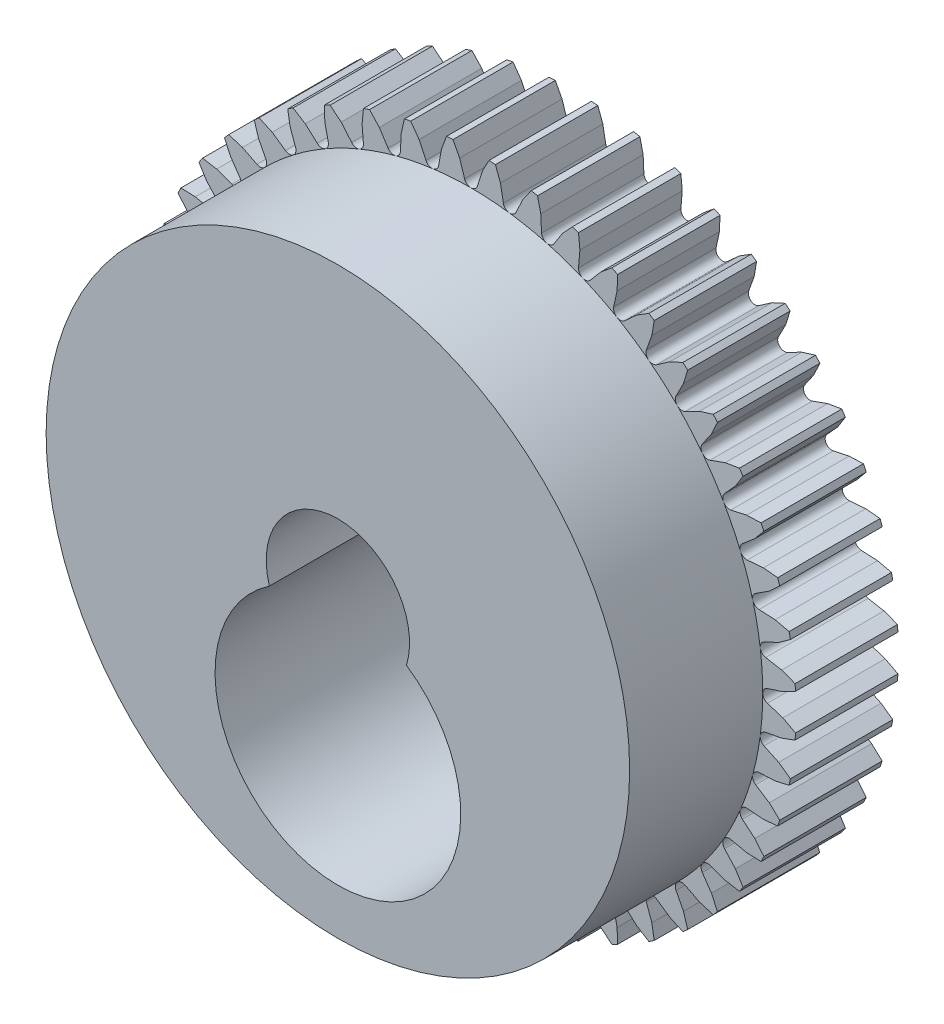
from build123d import *

# Parameters (mm, degrees)
BOSS_EXTRUDE1_DEPTH = 5
BOSS_EXTRUDE2_START = -5
SKETCH3_R           = 14.25
BOSS_EXTRUDE2_DEPTH = 11.5
CUT_EXTRUDE1_DEPTH  = 26.193798375


with BuildPart() as part:
    # Sketch2 → Boss-Extrude1 (new body)
    with BuildSketch(Plane.XY):
        with BuildLine():
            Line((-0.552366914, 15.229986566), (-0.881411777, 15.85051224))
            ThreePointArc((-0.881411777, 15.85051224), (-1.038274677, 15.841010406), (-1.19503583, 15.829956234))
            Line((-1.19503583, 15.829956234), (-1.440270816, 15.171790269))
            Line((-1.440270816, 15.171790269), (-1.581199665, 14.393740022))
            ThreePointArc((-1.581199665, 14.393740022), (-1.859998239, 14.128089275), (-2.198052455, 14.312529812))
            Line((-2.198052455, 14.312529812), (-2.535553492, 15.027593569))
            Line((-2.535553492, 15.027593569), (-2.942778185, 15.599861588))
            ThreePointArc((-2.942778185, 15.599861588), (-3.097058862, 15.569966326), (-3.251036043, 15.538545287))
            Line((-3.251036043, 15.538545287), (-3.408265112, 14.854000435))
            Line((-3.408265112, 14.854000435), (-3.446432359, 14.064211609))
            ThreePointArc((-3.446432359, 14.064211609), (-3.688171393, 13.764443025), (-4.047407829, 13.903180718))
            Line((-4.047407829, 13.903180718), (-4.475356048, 14.568074281))
            Line((-4.475356048, 14.568074281), (-4.953792842, 15.082292978))
            ThreePointArc((-4.953792842, 15.082292978), (-5.102851512, 15.032515806), (-5.251410128, 14.981265523))
            Line((-5.251410128, 14.981265523), (-5.317943048, 14.282054535))
            Line((-5.317943048, 14.282054535), (-5.252695641, 13.494040637))
            ThreePointArc((-5.252695641, 13.494040637), (-5.453238911, 13.165283338), (-5.827510933, 13.255944347))
            Line((-5.827510933, 13.255944347), (-6.33858402, 13.859291202))
            Line((-6.33858402, 13.859291202), (-6.88004673, 14.306662154))
            ThreePointArc((-6.88004673, 14.306662154), (-7.021332957, 14.237854772), (-7.16193113, 14.167652152))
            Line((-7.16193113, 14.167652152), (-7.136629503, 13.465738722))
            Line((-7.136629503, 13.465738722), (-6.969083843, 12.692982888))
            ThreePointArc((-6.969083843, 12.692982888), (-7.125, 12.340862004), (-7.507903709, 12.381895093))
            Line((-7.507903709, 12.381895093), (-8.093357062, 12.913371808))
            Line((-8.093357062, 12.913371808), (-8.688581111, 13.286240374))
            ThreePointArc((-8.688581111, 13.286240374), (-8.819677449, 13.199580095), (-8.949909504, 13.111626324))
            Line((-8.949909504, 13.111626324), (-8.833206249, 12.419020386))
            Line((-8.833206249, 12.419020386), (-8.566229089, 11.674744682))
            ThreePointArc((-8.566229089, 11.674744682), (-8.674850363, 11.305285099), (-9.059834171, 11.295988182))
            Line((-9.059834171, 11.295988182), (-9.709650522, 11.746501043))
            Line((-9.709650522, 11.746501043), (-10.34845146, 12.038487338))
            ThreePointArc((-10.34845146, 12.038487338), (-10.467114815, 11.935456944), (-10.584752446, 11.831256935))
            Line((-10.584752446, 11.831256935), (-10.378644388, 11.159809169))
            Line((-10.378644388, 11.159809169), (-10.01680378, 10.456748358))
            ThreePointArc((-10.01680378, 10.456748358), (-10.076271632, 10.076271632), (-10.456748358, 10.01680378))
            Line((-10.456748358, 10.01680378), (-11.159809169, 10.378644388))
            Line((-11.159809169, 10.378644388), (-11.831256935, 10.584752446))
            ThreePointArc((-11.831256935, 10.584752446), (-11.935456944, 10.467114815), (-12.038487338, 10.34845146))
            Line((-12.038487338, 10.34845146), (-11.746501043, 9.709650522))
            Line((-11.746501043, 9.709650522), (-11.295988182, 9.059834171))
            ThreePointArc((-11.295988182, 9.059834171), (-11.305285099, 8.674850363), (-11.674744682, 8.566229089))
            Line((-11.674744682, 8.566229089), (-12.419020386, 8.833206249))
            Line((-12.419020386, 8.833206249), (-13.111626324, 8.949909504))
            ThreePointArc((-13.111626324, 8.949909504), (-13.199580095, 8.819677449), (-13.286240374, 8.688581111))
            Line((-13.286240374, 8.688581111), (-12.913371808, 8.093357062))
            Line((-12.913371808, 8.093357062), (-12.381895093, 7.507903709))
            ThreePointArc((-12.381895093, 7.507903709), (-12.340862004, 7.125), (-12.692982888, 6.969083843))
            Line((-12.692982888, 6.969083843), (-13.465738722, 7.136629503))
            Line((-13.465738722, 7.136629503), (-14.167652152, 7.16193113))
            ThreePointArc((-14.167652152, 7.16193113), (-14.237854772, 7.021332957), (-14.306662154, 6.88004673))
            Line((-14.306662154, 6.88004673), (-13.859291202, 6.33858402))
            Line((-13.859291202, 6.33858402), (-13.255944347, 5.827510933))
            ThreePointArc((-13.255944347, 5.827510933), (-13.165283338, 5.453238911), (-13.494040637, 5.252695641))
            Line((-13.494040637, 5.252695641), (-14.282054535, 5.317943048))
            Line((-14.282054535, 5.317943048), (-14.981265523, 5.251410128))
            ThreePointArc((-14.981265523, 5.251410128), (-15.032515806, 5.102851512), (-15.082292978, 4.953792842))
            Line((-15.082292978, 4.953792842), (-14.568074281, 4.475356048))
            Line((-14.568074281, 4.475356048), (-13.903180718, 4.047407829))
            ThreePointArc((-13.903180718, 4.047407829), (-13.764443025, 3.688171393), (-14.064211609, 3.446432359))
            Line((-14.064211609, 3.446432359), (-14.854000435, 3.408265112))
            Line((-14.854000435, 3.408265112), (-15.538545287, 3.251036043))
            ThreePointArc((-15.538545287, 3.251036043), (-15.569966326, 3.097058862), (-15.599861588, 2.942778185))
            Line((-15.599861588, 2.942778185), (-15.027593569, 2.535553492))
            Line((-15.027593569, 2.535553492), (-14.312529812, 2.198052455))
            ThreePointArc((-14.312529812, 2.198052455), (-14.128089275, 1.859998239), (-14.393740022, 1.581199665))
            Line((-14.393740022, 1.581199665), (-15.171790269, 1.440270816))
            Line((-15.171790269, 1.440270816), (-15.829956234, 1.19503583))
            ThreePointArc((-15.829956234, 1.19503583), (-15.841010406, 1.038274677), (-15.85051224, 0.881411777))
            Line((-15.85051224, 0.881411777), (-15.229986566, 0.552366914))
            Line((-15.229986566, 0.552366914), (-14.476987552, 0.311087794))
            ThreePointArc((-14.476987552, 0.311087794), (-14.25, 0), (-14.476987552, -0.311087794))
            Line((-14.476987552, -0.311087794), (-15.229986566, -0.552366914))
            Line((-15.229986566, -0.552366914), (-15.85051224, -0.881411777))
            ThreePointArc((-15.85051224, -0.881411777), (-15.841010406, -1.038274677), (-15.829956234, -1.19503583))
            Line((-15.829956234, -1.19503583), (-15.171790269, -1.440270816))
            Line((-15.171790269, -1.440270816), (-14.393740022, -1.581199665))
            ThreePointArc((-14.393740022, -1.581199665), (-14.128089275, -1.859998239), (-14.312529812, -2.198052455))
            Line((-14.312529812, -2.198052455), (-15.027593569, -2.535553492))
            Line((-15.027593569, -2.535553492), (-15.599861588, -2.942778185))
            ThreePointArc((-15.599861588, -2.942778185), (-15.569966326, -3.097058862), (-15.538545287, -3.251036043))
            Line((-15.538545287, -3.251036043), (-14.854000435, -3.408265112))
            Line((-14.854000435, -3.408265112), (-14.064211609, -3.446432359))
            ThreePointArc((-14.064211609, -3.446432359), (-13.764443025, -3.688171393), (-13.903180718, -4.047407829))
            Line((-13.903180718, -4.047407829), (-14.568074281, -4.475356048))
            Line((-14.568074281, -4.475356048), (-15.082292978, -4.953792842))
            ThreePointArc((-15.082292978, -4.953792842), (-15.032515806, -5.102851512), (-14.981265523, -5.251410128))
            Line((-14.981265523, -5.251410128), (-14.282054535, -5.317943048))
            Line((-14.282054535, -5.317943048), (-13.494040637, -5.252695641))
            ThreePointArc((-13.494040637, -5.252695641), (-13.165283338, -5.453238911), (-13.255944347, -5.827510933))
            Line((-13.255944347, -5.827510933), (-13.859291202, -6.33858402))
            Line((-13.859291202, -6.33858402), (-14.306662154, -6.88004673))
            ThreePointArc((-14.306662154, -6.88004673), (-14.237854772, -7.021332957), (-14.167652152, -7.16193113))
            Line((-14.167652152, -7.16193113), (-13.465738722, -7.136629503))
            Line((-13.465738722, -7.136629503), (-12.692982888, -6.969083843))
            ThreePointArc((-12.692982888, -6.969083843), (-12.340862004, -7.125), (-12.381895093, -7.507903709))
            Line((-12.381895093, -7.507903709), (-12.913371808, -8.093357062))
            Line((-12.913371808, -8.093357062), (-13.286240374, -8.688581111))
            ThreePointArc((-13.286240374, -8.688581111), (-13.199580095, -8.819677449), (-13.111626324, -8.949909504))
            Line((-13.111626324, -8.949909504), (-12.419020386, -8.833206249))
            Line((-12.419020386, -8.833206249), (-11.674744682, -8.566229089))
            ThreePointArc((-11.674744682, -8.566229089), (-11.305285099, -8.674850363), (-11.295988182, -9.059834171))
            Line((-11.295988182, -9.059834171), (-11.746501043, -9.709650522))
            Line((-11.746501043, -9.709650522), (-12.038487338, -10.34845146))
            ThreePointArc((-12.038487338, -10.34845146), (-11.935456944, -10.467114815), (-11.831256935, -10.584752446))
            Line((-11.831256935, -10.584752446), (-11.159809169, -10.378644388))
            Line((-11.159809169, -10.378644388), (-10.456748358, -10.01680378))
            ThreePointArc((-10.456748358, -10.01680378), (-10.076271632, -10.076271632), (-10.01680378, -10.456748358))
            Line((-10.01680378, -10.456748358), (-10.378644388, -11.159809169))
            Line((-10.378644388, -11.159809169), (-10.584752446, -11.831256935))
            ThreePointArc((-10.584752446, -11.831256935), (-10.467114815, -11.935456944), (-10.34845146, -12.038487338))
            Line((-10.34845146, -12.038487338), (-9.709650522, -11.746501043))
            Line((-9.709650522, -11.746501043), (-9.059834171, -11.295988182))
            ThreePointArc((-9.059834171, -11.295988182), (-8.674850363, -11.305285099), (-8.566229089, -11.674744682))
            Line((-8.566229089, -11.674744682), (-8.833206249, -12.419020386))
            Line((-8.833206249, -12.419020386), (-8.949909504, -13.111626324))
            ThreePointArc((-8.949909504, -13.111626324), (-8.819677449, -13.199580095), (-8.688581111, -13.286240374))
            Line((-8.688581111, -13.286240374), (-8.093357062, -12.913371808))
            Line((-8.093357062, -12.913371808), (-7.507903709, -12.381895093))
            ThreePointArc((-7.507903709, -12.381895093), (-7.125, -12.340862004), (-6.969083843, -12.692982888))
            Line((-6.969083843, -12.692982888), (-7.136629503, -13.465738722))
            Line((-7.136629503, -13.465738722), (-7.16193113, -14.167652152))
            ThreePointArc((-7.16193113, -14.167652152), (-7.021332957, -14.237854772), (-6.88004673, -14.306662154))
            Line((-6.88004673, -14.306662154), (-6.33858402, -13.859291202))
            Line((-6.33858402, -13.859291202), (-5.827510933, -13.255944347))
            ThreePointArc((-5.827510933, -13.255944347), (-5.453238911, -13.165283338), (-5.252695641, -13.494040637))
            Line((-5.252695641, -13.494040637), (-5.317943048, -14.282054535))
            Line((-5.317943048, -14.282054535), (-5.251410128, -14.981265523))
            ThreePointArc((-5.251410128, -14.981265523), (-5.102851512, -15.032515806), (-4.953792842, -15.082292978))
            Line((-4.953792842, -15.082292978), (-4.475356048, -14.568074281))
            Line((-4.475356048, -14.568074281), (-4.047407829, -13.903180718))
            ThreePointArc((-4.047407829, -13.903180718), (-3.688171393, -13.764443025), (-3.446432359, -14.064211609))
            Line((-3.446432359, -14.064211609), (-3.408265112, -14.854000435))
            Line((-3.408265112, -14.854000435), (-3.251036043, -15.538545287))
            ThreePointArc((-3.251036043, -15.538545287), (-3.097058862, -15.569966326), (-2.942778185, -15.599861588))
            Line((-2.942778185, -15.599861588), (-2.535553492, -15.027593569))
            Line((-2.535553492, -15.027593569), (-2.198052455, -14.312529812))
            ThreePointArc((-2.198052455, -14.312529812), (-1.859998239, -14.128089275), (-1.581199665, -14.393740022))
            Line((-1.581199665, -14.393740022), (-1.440270816, -15.171790269))
            Line((-1.440270816, -15.171790269), (-1.19503583, -15.829956234))
            ThreePointArc((-1.19503583, -15.829956234), (-1.038274677, -15.841010406), (-0.881411777, -15.85051224))
            Line((-0.881411777, -15.85051224), (-0.552366914, -15.229986566))
            Line((-0.552366914, -15.229986566), (-0.311087794, -14.476987552))
            ThreePointArc((-0.311087794, -14.476987552), (0, -14.25), (0.311087794, -14.476987552))
            Line((0.311087794, -14.476987552), (0.552366914, -15.229986566))
            Line((0.552366914, -15.229986566), (0.881411777, -15.85051224))
            ThreePointArc((0.881411777, -15.85051224), (1.038274677, -15.841010406), (1.19503583, -15.829956234))
            Line((1.19503583, -15.829956234), (1.440270816, -15.171790269))
            Line((1.440270816, -15.171790269), (1.581199665, -14.393740022))
            ThreePointArc((1.581199665, -14.393740022), (1.859998239, -14.128089275), (2.198052455, -14.312529812))
            Line((2.198052455, -14.312529812), (2.535553492, -15.027593569))
            Line((2.535553492, -15.027593569), (2.942778185, -15.599861588))
            ThreePointArc((2.942778185, -15.599861588), (3.097058862, -15.569966326), (3.251036043, -15.538545287))
            Line((3.251036043, -15.538545287), (3.408265112, -14.854000435))
            Line((3.408265112, -14.854000435), (3.446432359, -14.064211609))
            ThreePointArc((3.446432359, -14.064211609), (3.688171393, -13.764443025), (4.047407829, -13.903180718))
            Line((4.047407829, -13.903180718), (4.475356048, -14.568074281))
            Line((4.475356048, -14.568074281), (4.953792842, -15.082292978))
            ThreePointArc((4.953792842, -15.082292978), (5.102851512, -15.032515806), (5.251410128, -14.981265523))
            Line((5.251410128, -14.981265523), (5.317943048, -14.282054535))
            Line((5.317943048, -14.282054535), (5.252695641, -13.494040637))
            ThreePointArc((5.252695641, -13.494040637), (5.453238911, -13.165283338), (5.827510933, -13.255944347))
            Line((5.827510933, -13.255944347), (6.33858402, -13.859291202))
            Line((6.33858402, -13.859291202), (6.88004673, -14.306662154))
            ThreePointArc((6.88004673, -14.306662154), (7.021332957, -14.237854772), (7.16193113, -14.167652152))
            Line((7.16193113, -14.167652152), (7.136629503, -13.465738722))
            Line((7.136629503, -13.465738722), (6.969083843, -12.692982888))
            ThreePointArc((6.969083843, -12.692982888), (7.125, -12.340862004), (7.507903709, -12.381895093))
            Line((7.507903709, -12.381895093), (8.093357062, -12.913371808))
            Line((8.093357062, -12.913371808), (8.688581111, -13.286240374))
            ThreePointArc((8.688581111, -13.286240374), (8.819677449, -13.199580095), (8.949909504, -13.111626324))
            Line((8.949909504, -13.111626324), (8.833206249, -12.419020386))
            Line((8.833206249, -12.419020386), (8.566229089, -11.674744682))
            ThreePointArc((8.566229089, -11.674744682), (8.674850363, -11.305285099), (9.059834171, -11.295988182))
            Line((9.059834171, -11.295988182), (9.709650522, -11.746501043))
            Line((9.709650522, -11.746501043), (10.34845146, -12.038487338))
            ThreePointArc((10.34845146, -12.038487338), (10.467114815, -11.935456944), (10.584752446, -11.831256935))
            Line((10.584752446, -11.831256935), (10.378644388, -11.159809169))
            Line((10.378644388, -11.159809169), (10.01680378, -10.456748358))
            ThreePointArc((10.01680378, -10.456748358), (10.076271632, -10.076271632), (10.456748358, -10.01680378))
            Line((10.456748358, -10.01680378), (11.159809169, -10.378644388))
            Line((11.159809169, -10.378644388), (11.831256935, -10.584752446))
            ThreePointArc((11.831256935, -10.584752446), (11.935456944, -10.467114815), (12.038487338, -10.34845146))
            Line((12.038487338, -10.34845146), (11.746501043, -9.709650522))
            Line((11.746501043, -9.709650522), (11.295988182, -9.059834171))
            ThreePointArc((11.295988182, -9.059834171), (11.305285099, -8.674850363), (11.674744682, -8.566229089))
            Line((11.674744682, -8.566229089), (12.419020386, -8.833206249))
            Line((12.419020386, -8.833206249), (13.111626324, -8.949909504))
            ThreePointArc((13.111626324, -8.949909504), (13.199580095, -8.819677449), (13.286240374, -8.688581111))
            Line((13.286240374, -8.688581111), (12.913371808, -8.093357062))
            Line((12.913371808, -8.093357062), (12.381895093, -7.507903709))
            ThreePointArc((12.381895093, -7.507903709), (12.340862004, -7.125), (12.692982888, -6.969083843))
            Line((12.692982888, -6.969083843), (13.465738722, -7.136629503))
            Line((13.465738722, -7.136629503), (14.167652152, -7.16193113))
            ThreePointArc((14.167652152, -7.16193113), (14.237854772, -7.021332957), (14.306662154, -6.88004673))
            Line((14.306662154, -6.88004673), (13.859291202, -6.33858402))
            Line((13.859291202, -6.33858402), (13.255944347, -5.827510933))
            ThreePointArc((13.255944347, -5.827510933), (13.165283338, -5.453238911), (13.494040637, -5.252695641))
            Line((13.494040637, -5.252695641), (14.282054535, -5.317943048))
            Line((14.282054535, -5.317943048), (14.981265523, -5.251410128))
            ThreePointArc((14.981265523, -5.251410128), (15.032515806, -5.102851512), (15.082292978, -4.953792842))
            Line((15.082292978, -4.953792842), (14.568074281, -4.475356048))
            Line((14.568074281, -4.475356048), (13.903180718, -4.047407829))
            ThreePointArc((13.903180718, -4.047407829), (13.764443025, -3.688171393), (14.064211609, -3.446432359))
            Line((14.064211609, -3.446432359), (14.854000435, -3.408265112))
            Line((14.854000435, -3.408265112), (15.538545287, -3.251036043))
            ThreePointArc((15.538545287, -3.251036043), (15.569966326, -3.097058862), (15.599861588, -2.942778185))
            Line((15.599861588, -2.942778185), (15.027593569, -2.535553492))
            Line((15.027593569, -2.535553492), (14.312529812, -2.198052455))
            ThreePointArc((14.312529812, -2.198052455), (14.128089275, -1.859998239), (14.393740022, -1.581199665))
            Line((14.393740022, -1.581199665), (15.171790269, -1.440270816))
            Line((15.171790269, -1.440270816), (15.829956234, -1.19503583))
            ThreePointArc((15.829956234, -1.19503583), (15.841010406, -1.038274677), (15.85051224, -0.881411777))
            Line((15.85051224, -0.881411777), (15.229986566, -0.552366914))
            Line((15.229986566, -0.552366914), (14.476987552, -0.311087794))
            ThreePointArc((14.476987552, -0.311087794), (14.25, 0), (14.476987552, 0.311087794))
            Line((14.476987552, 0.311087794), (15.229986566, 0.552366914))
            Line((15.229986566, 0.552366914), (15.85051224, 0.881411777))
            ThreePointArc((15.85051224, 0.881411777), (15.841010406, 1.038274677), (15.829956234, 1.19503583))
            Line((15.829956234, 1.19503583), (15.171790269, 1.440270816))
            Line((15.171790269, 1.440270816), (14.393740022, 1.581199665))
            ThreePointArc((14.393740022, 1.581199665), (14.128089275, 1.859998239), (14.312529812, 2.198052455))
            Line((14.312529812, 2.198052455), (15.027593569, 2.535553492))
            Line((15.027593569, 2.535553492), (15.599861588, 2.942778185))
            ThreePointArc((15.599861588, 2.942778185), (15.569966326, 3.097058862), (15.538545287, 3.251036043))
            Line((15.538545287, 3.251036043), (14.854000435, 3.408265112))
            Line((14.854000435, 3.408265112), (14.064211609, 3.446432359))
            ThreePointArc((14.064211609, 3.446432359), (13.764443025, 3.688171393), (13.903180718, 4.047407829))
            Line((13.903180718, 4.047407829), (14.568074281, 4.475356048))
            Line((14.568074281, 4.475356048), (15.082292978, 4.953792842))
            ThreePointArc((15.082292978, 4.953792842), (15.032515806, 5.102851512), (14.981265523, 5.251410128))
            Line((14.981265523, 5.251410128), (14.282054535, 5.317943048))
            Line((14.282054535, 5.317943048), (13.494040637, 5.252695641))
            ThreePointArc((13.494040637, 5.252695641), (13.165283338, 5.453238911), (13.255944347, 5.827510933))
            Line((13.255944347, 5.827510933), (13.859291202, 6.33858402))
            Line((13.859291202, 6.33858402), (14.306662154, 6.88004673))
            ThreePointArc((14.306662154, 6.88004673), (14.237854772, 7.021332957), (14.167652152, 7.16193113))
            Line((14.167652152, 7.16193113), (13.465738722, 7.136629503))
            Line((13.465738722, 7.136629503), (12.692982888, 6.969083843))
            ThreePointArc((12.692982888, 6.969083843), (12.340862004, 7.125), (12.381895093, 7.507903709))
            Line((12.381895093, 7.507903709), (12.913371808, 8.093357062))
            Line((12.913371808, 8.093357062), (13.286240374, 8.688581111))
            ThreePointArc((13.286240374, 8.688581111), (13.199580095, 8.819677449), (13.111626324, 8.949909504))
            Line((13.111626324, 8.949909504), (12.419020386, 8.833206249))
            Line((12.419020386, 8.833206249), (11.674744682, 8.566229089))
            ThreePointArc((11.674744682, 8.566229089), (11.305285099, 8.674850363), (11.295988182, 9.059834171))
            Line((11.295988182, 9.059834171), (11.746501043, 9.709650522))
            Line((11.746501043, 9.709650522), (12.038487338, 10.34845146))
            ThreePointArc((12.038487338, 10.34845146), (11.935456944, 10.467114815), (11.831256935, 10.584752446))
            Line((11.831256935, 10.584752446), (11.159809169, 10.378644388))
            Line((11.159809169, 10.378644388), (10.456748358, 10.01680378))
            ThreePointArc((10.456748358, 10.01680378), (10.076271632, 10.076271632), (10.01680378, 10.456748358))
            Line((10.01680378, 10.456748358), (10.378644388, 11.159809169))
            Line((10.378644388, 11.159809169), (10.584752446, 11.831256935))
            ThreePointArc((10.584752446, 11.831256935), (10.467114815, 11.935456944), (10.34845146, 12.038487338))
            Line((10.34845146, 12.038487338), (9.709650522, 11.746501043))
            Line((9.709650522, 11.746501043), (9.059834171, 11.295988182))
            ThreePointArc((9.059834171, 11.295988182), (8.674850363, 11.305285099), (8.566229089, 11.674744682))
            Line((8.566229089, 11.674744682), (8.833206249, 12.419020386))
            Line((8.833206249, 12.419020386), (8.949909504, 13.111626324))
            ThreePointArc((8.949909504, 13.111626324), (8.819677449, 13.199580095), (8.688581111, 13.286240374))
            Line((8.688581111, 13.286240374), (8.093357062, 12.913371808))
            Line((8.093357062, 12.913371808), (7.507903709, 12.381895093))
            ThreePointArc((7.507903709, 12.381895093), (7.125, 12.340862004), (6.969083843, 12.692982888))
            Line((6.969083843, 12.692982888), (7.136629503, 13.465738722))
            Line((7.136629503, 13.465738722), (7.16193113, 14.167652152))
            ThreePointArc((7.16193113, 14.167652152), (7.021332957, 14.237854772), (6.88004673, 14.306662154))
            Line((6.88004673, 14.306662154), (6.33858402, 13.859291202))
            Line((6.33858402, 13.859291202), (5.827510933, 13.255944347))
            ThreePointArc((5.827510933, 13.255944347), (5.453238911, 13.165283338), (5.252695641, 13.494040637))
            Line((5.252695641, 13.494040637), (5.317943048, 14.282054535))
            Line((5.317943048, 14.282054535), (5.251410128, 14.981265523))
            ThreePointArc((5.251410128, 14.981265523), (5.102851512, 15.032515806), (4.953792842, 15.082292978))
            Line((4.953792842, 15.082292978), (4.475356048, 14.568074281))
            Line((4.475356048, 14.568074281), (4.047407829, 13.903180718))
            ThreePointArc((4.047407829, 13.903180718), (3.688171393, 13.764443025), (3.446432359, 14.064211609))
            Line((3.446432359, 14.064211609), (3.408265112, 14.854000435))
            Line((3.408265112, 14.854000435), (3.251036043, 15.538545287))
            ThreePointArc((3.251036043, 15.538545287), (3.097058862, 15.569966326), (2.942778185, 15.599861588))
            Line((2.942778185, 15.599861588), (2.535553492, 15.027593569))
            Line((2.535553492, 15.027593569), (2.198052455, 14.312529812))
            ThreePointArc((2.198052455, 14.312529812), (1.859998239, 14.128089275), (1.581199665, 14.393740022))
            Line((1.581199665, 14.393740022), (1.440270816, 15.171790269))
            Line((1.440270816, 15.171790269), (1.19503583, 15.829956234))
            ThreePointArc((1.19503583, 15.829956234), (1.038274677, 15.841010406), (0.881411777, 15.85051224))
            Line((0.881411777, 15.85051224), (0.552366914, 15.229986566))
            Line((0.552366914, 15.229986566), (0.311087794, 14.476987552))
            ThreePointArc((0.311087794, 14.476987552), (0, 14.25), (-0.311087794, 14.476987552))
            Line((-0.311087794, 14.476987552), (-0.552366914, 15.229986566))
        make_face()
    extrude(amount=BOSS_EXTRUDE1_DEPTH)

    # Sketch3 → Boss-Extrude2 (add)
    with BuildSketch(Plane.XY.offset(5).offset(BOSS_EXTRUDE2_START)):
        Circle(SKETCH3_R)
    extrude(amount=BOSS_EXTRUDE2_DEPTH)

    # Sketch4 → Cut-Extrude1 (cut, through all)
    with BuildSketch(Plane(origin=(0, 0, 0), x_dir=(-1, 0, 0), z_dir=(0, 0, -1))):
        with BuildLine():
            ThreePointArc((3.347820083, -1.020833333), (0, 3.5), (-3.347820083, -1.020833333))
            ThreePointArc((-3.347820083, -1.020833333), (0, -12), (3.347820083, -1.020833333))
        make_face()
    extrude(amount=-CUT_EXTRUDE1_DEPTH, mode=Mode.SUBTRACT)


solid = part.part
